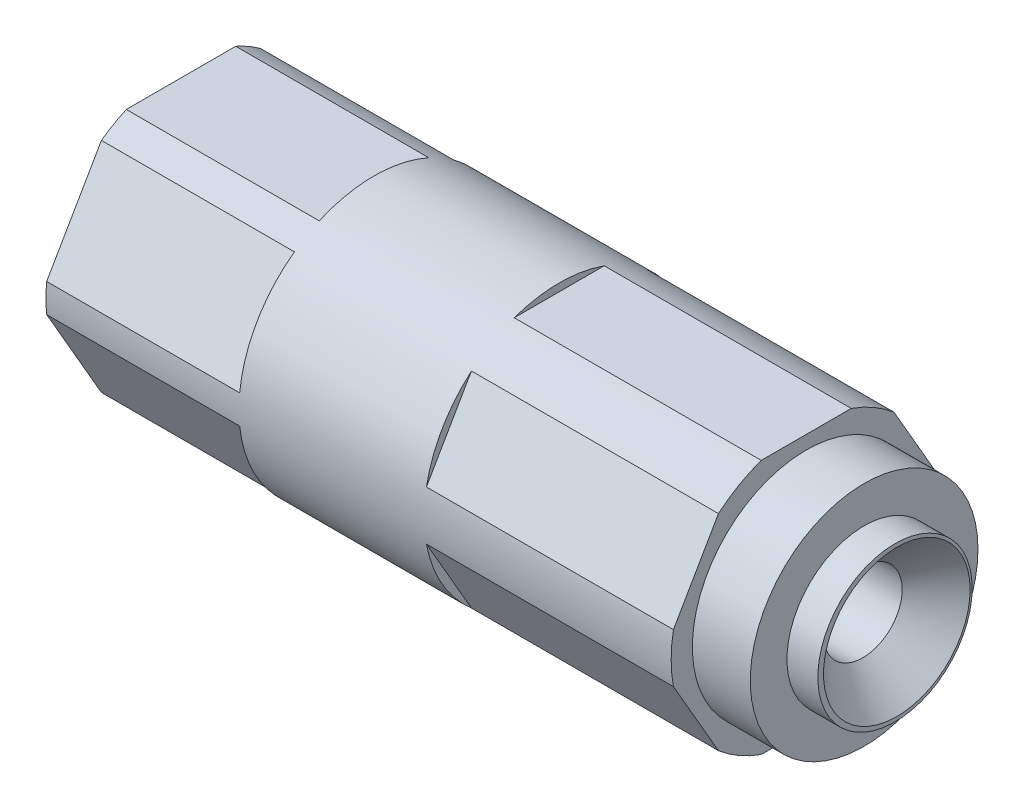
from build123d import *

# Parameters (mm, degrees)
SKETCH5_OUTSIDE_W                 = 57.982
SKETCH5_OUTSIDE_H                 = 57.982
CUT_EXTRUDE3_DEPTH                = 25
M10X1_5_TAPPED_HOLE1_D            = 8.5
M10X1_5_TAPPED_HOLE1_DEPTH        = 24.5
M10X1_5_TAPPED_HOLE1_TIP          = 2.553657631
SKETCH9_OUTSIDE_W                 = 57.982
SKETCH9_OUTSIDE_H                 = 57.982
CUT_EXTRUDE5_DEPTH                = 32
M12X1_75_TAPPED_HOLE1_D           = 10.2
M12X1_75_TAPPED_HOLE1_DEPTH       = 29.25
M12X1_75_TAPPED_HOLE1_CSINK_D     = 19
M12X1_75_TAPPED_HOLE1_CSINK_ANGLE = 90
M12X1_75_TAPPED_HOLE1_TIP         = 3.064389157


with BuildPart() as part:
    # Sketch1 → Revolve1 (revolve)
    with BuildSketch(Plane.XY, mode=Mode.PRIVATE) as revolve1_sk:
        Polygon((0, 0), (0, 17.5), (81, 17.5), (81, 14.75), (88.5, 14.75), (88.5, 10), (92.5, 10), (92.5, 0), (81, 0), align=None)
    revolve(revolve1_sk.sketch.rotate(Axis((0, 0, 0), (-1, 0, 0)), 90), axis=Axis((0, 0, 0), (-1, 0, 0)))

    # Sketch5 outside → Cut-Extrude3 (cut)
    with BuildSketch(Plane.ZY):
        Rectangle(SKETCH5_OUTSIDE_W, SKETCH5_OUTSIDE_H)
        Polygon((9.237604307, 16), (-9.237604307, 16), (-18.475208614, 0), (-9.237604307, -16), (9.237604307, -16), (18.475208614, 0), align=None, mode=Mode.SUBTRACT)
    extrude(amount=-CUT_EXTRUDE3_DEPTH, mode=Mode.SUBTRACT)

    # M10x1.5 Tapped Hole1
    with Locations(Plane.ZY):
        with Locations((0, 0)):
            Hole(M10X1_5_TAPPED_HOLE1_D / 2, depth=M10X1_5_TAPPED_HOLE1_DEPTH)
            with Locations((0, 0, -(M10X1_5_TAPPED_HOLE1_DEPTH + M10X1_5_TAPPED_HOLE1_TIP / 2))):  # 118° drill point
                Cone(0, M10X1_5_TAPPED_HOLE1_D / 2, M10X1_5_TAPPED_HOLE1_TIP, mode=Mode.SUBTRACT)

    # Sketch9 outside → Cut-Extrude5 (cut)
    with BuildSketch(Plane(origin=(81, 0, 0), x_dir=(0, 0, -1), z_dir=(1, 0, 0))):
        Rectangle(SKETCH9_OUTSIDE_W, SKETCH9_OUTSIDE_H)
        Polygon((-9.526279442, -16.5), (9.526279442, -16.5), (19.052558883, 0), (9.526279442, 16.5), (-9.526279442, 16.5), (-19.052558883, 0), align=None, mode=Mode.SUBTRACT)
    extrude(amount=-CUT_EXTRUDE5_DEPTH, mode=Mode.SUBTRACT)

    # M12x1.75 Tapped Hole1
    with Locations(Plane(origin=(92.5, 0, 0), x_dir=(0, 0, -1), z_dir=(1, 0, 0))):
        with Locations((0.231792895, -0.025036362)):
            CounterSinkHole(M12X1_75_TAPPED_HOLE1_D / 2, M12X1_75_TAPPED_HOLE1_CSINK_D / 2, depth=M12X1_75_TAPPED_HOLE1_DEPTH, counter_sink_angle=M12X1_75_TAPPED_HOLE1_CSINK_ANGLE)
            with Locations((0, 0, -(M12X1_75_TAPPED_HOLE1_DEPTH + M12X1_75_TAPPED_HOLE1_TIP / 2))):  # 118° drill point
                Cone(0, M12X1_75_TAPPED_HOLE1_D / 2, M12X1_75_TAPPED_HOLE1_TIP, mode=Mode.SUBTRACT)


solid = part.part
